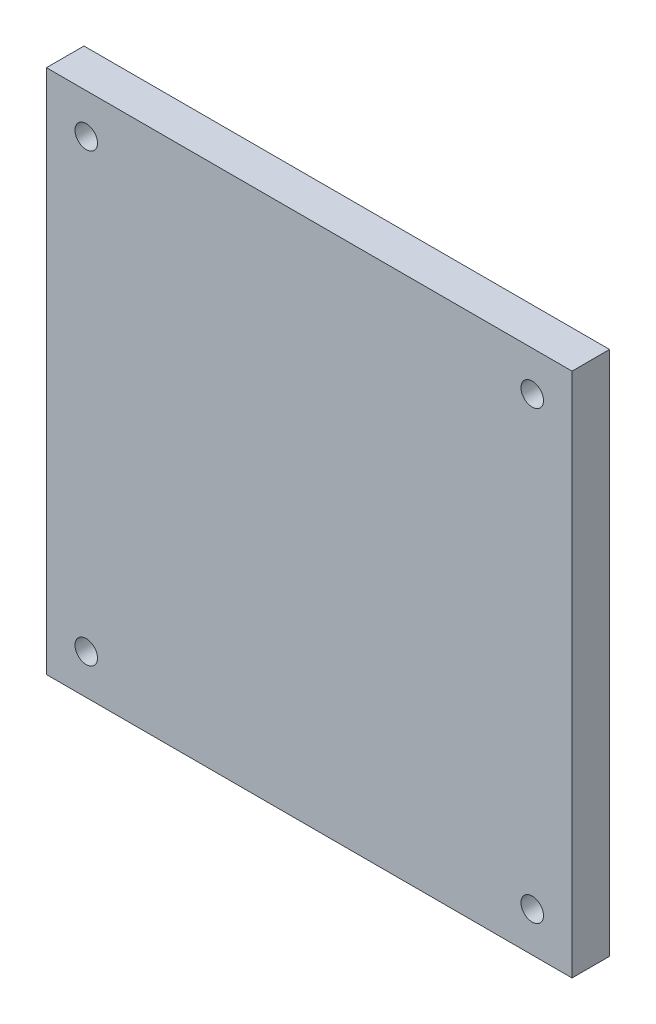
from build123d import *

# Parameters (mm, degrees)
SKETCH_1_W          = 70
SKETCH_1_H          = 70
EXTRUDE_1_DEPTH     = 5
SKETCH_3_R          = 1.5
CUT_EXTRUDE_1_DEPTH = 5


with BuildPart() as part:
    # Эскиз1 → Бобышка-Вытянуть1 (new body)
    with BuildSketch(Plane.XY):
        Rectangle(SKETCH_1_W, SKETCH_1_H)
    extrude(amount=EXTRUDE_1_DEPTH)

    # Эскиз3 → Вырез-Вытянуть1 (cut)
    with BuildSketch(Plane.XY.offset(5)):
        with Locations((-29.7, 29.7)):
            Circle(SKETCH_3_R)
        with Locations((29.7, 29.7)):
            Circle(SKETCH_3_R)
        with Locations((29.7, -29.7)):
            Circle(SKETCH_3_R)
        with Locations((-29.7, -29.7)):
            Circle(SKETCH_3_R)
    extrude(amount=-CUT_EXTRUDE_1_DEPTH, mode=Mode.SUBTRACT)


solid = part.part
